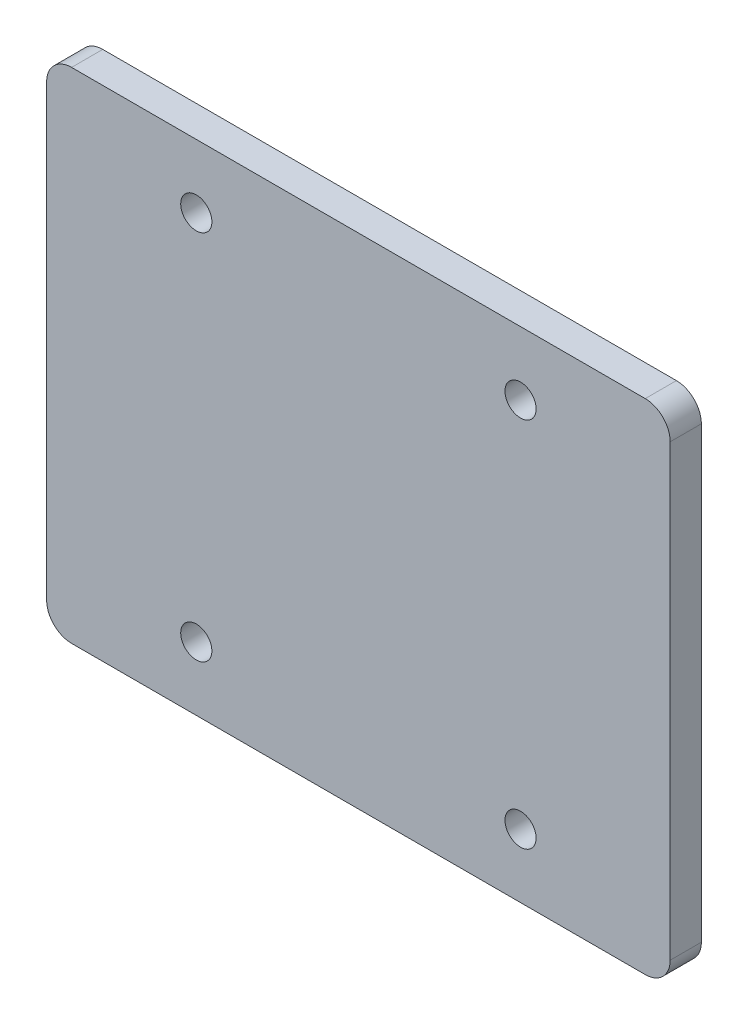
from build123d import *

# Parameters (mm, degrees)
SKETCH1_W           = 63.5
SKETCH1_H           = 50.8
BOSS_EXTRUDE1_DEPTH = 3.175
FILLET1_R           = 2.54
SKETCH4_R           = 1.5875
CUT_EXTRUDE1_DEPTH  = 3.175


with BuildPart() as part:
    # Sketch1 → Boss-Extrude1 (new body)
    with BuildSketch(Plane.XY):
        with Locations((31.75, 25.4)):
            Rectangle(SKETCH1_W, SKETCH1_H)
    extrude(amount=BOSS_EXTRUDE1_DEPTH)

    # Fillet1
    fillet1_edges = [part.edges().sort_by_distance(p)[0] for p in [
        (0, 50.8, 1.5875),
        (63.5, 50.8, 1.5875),
        (63.5, 0, 1.5875),
        (0, 0, 1.5875),
    ]]
    fillet(fillet1_edges, radius=FILLET1_R)

    # Sketch4 → Cut-Extrude1 (cut)
    with BuildSketch(Plane.XY.offset(3.175)):
        with Locations(Location((15.24, 6.477, 0), (0, 0, 180))):
            Circle(SKETCH4_R)
        with Locations(Location((15.24, 44.323, 0), (0, 0, 180))):
            Circle(SKETCH4_R)
        with Locations(Location((48.26, 44.323, 0), (0, 0, 180))):
            Circle(SKETCH4_R)
        with Locations(Location((48.26, 6.477, 0), (0, 0, 180))):
            Circle(SKETCH4_R)
    extrude(amount=-CUT_EXTRUDE1_DEPTH, mode=Mode.SUBTRACT)


solid = part.part
